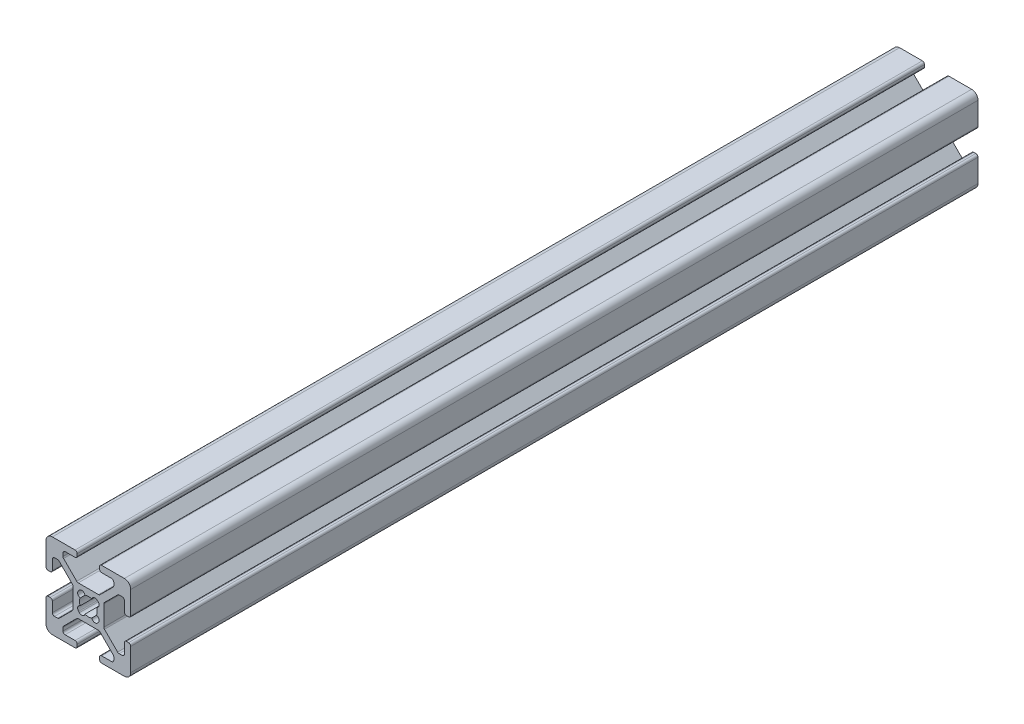
from build123d import *

# Parameters (mm, degrees)
BOSS_EXTRUDE1_DEPTH = 200


with BuildPart() as part:
    # Sketch1 → Boss-Extrude1 (new body)
    with BuildSketch(Plane(origin=(0, 0, -200), x_dir=(-1, 0, 0), z_dir=(0, 0, -1))):
        with BuildLine():
            Line((10, -8.5), (10, -3.138))
            ThreePointArc((10, -3.138), (9.851210245, -2.778789755), (9.492, -2.63))
            Line((9.492, -2.63), (9.008, -2.63))
            ThreePointArc((9.008, -2.63), (8.648789755, -2.778789755), (8.5, -3.138))
            Line((8.5, -3.138), (8.5, -5.487))
            ThreePointArc((8.5, -5.487), (8.351210245, -5.846210245), (7.992, -5.995))
            Line((7.992, -5.995), (7.26592049, -5.995))
            ThreePointArc((7.26592049, -5.995), (7.071517306, -5.956330803), (6.906710245, -5.846210245))
            Line((6.906710245, -5.846210245), (3.803789755, -2.743289755))
            ThreePointArc((3.803789755, -2.743289755), (3.693669197, -2.578482694), (3.655, -2.38407951))
            Line((3.655, -2.38407951), (3.655, 2.383759167))
            ThreePointArc((3.655, 2.383759167), (3.693669197, 2.57816235), (3.803789755, 2.742969412))
            Line((3.803789755, 2.742969412), (6.907030588, 5.846210245))
            ThreePointArc((6.907030588, 5.846210245), (7.07183765, 5.956330803), (7.266240833, 5.995))
            Line((7.266240833, 5.995), (7.992, 5.995))
            ThreePointArc((7.992, 5.995), (8.351210245, 5.846210245), (8.5, 5.487))
            Line((8.5, 5.487), (8.5, 3.138))
            ThreePointArc((8.5, 3.138), (8.648789755, 2.778789755), (9.008, 2.63))
            Line((9.008, 2.63), (9.492, 2.63))
            ThreePointArc((9.492, 2.63), (9.851210245, 2.778789755), (10, 3.138))
            Line((10, 3.138), (10, 8.5))
            ThreePointArc((10, 8.5), (9.560660172, 9.560660172), (8.5, 10))
            Line((8.5, 10), (3.138, 10))
            ThreePointArc((3.138, 10), (2.778789755, 9.851210245), (2.63, 9.492))
            Line((2.63, 9.492), (2.63, 9.008))
            ThreePointArc((2.63, 9.008), (2.778789755, 8.648789755), (3.138, 8.5))
            Line((3.138, 8.5), (5.487, 8.5))
            ThreePointArc((5.487, 8.5), (5.846210245, 8.351210245), (5.995, 7.992))
            Line((5.995, 7.992), (5.995, 7.26592049))
            ThreePointArc((5.995, 7.26592049), (5.956330803, 7.071517306), (5.846210245, 6.906710245))
            Line((5.846210245, 6.906710245), (2.743289755, 3.803789755))
            ThreePointArc((2.743289755, 3.803789755), (2.578482694, 3.693669197), (2.38407951, 3.655))
            Line((2.38407951, 3.655), (-2.383759167, 3.655))
            ThreePointArc((-2.383759167, 3.655), (-2.57816235, 3.693669197), (-2.742969412, 3.803789755))
            Line((-2.742969412, 3.803789755), (-5.846210245, 6.907030588))
            ThreePointArc((-5.846210245, 6.907030588), (-5.956330803, 7.07183765), (-5.995, 7.266240833))
            Line((-5.995, 7.266240833), (-5.995, 7.992))
            ThreePointArc((-5.995, 7.992), (-5.846210245, 8.351210245), (-5.487, 8.5))
            Line((-5.487, 8.5), (-3.138, 8.5))
            ThreePointArc((-3.138, 8.5), (-2.778789755, 8.648789755), (-2.63, 9.008))
            Line((-2.63, 9.008), (-2.63, 9.492))
            ThreePointArc((-2.63, 9.492), (-2.778789755, 9.851210245), (-3.138, 10))
            Line((-3.138, 10), (-8.5, 10))
            ThreePointArc((-8.5, 10), (-9.560660172, 9.560660172), (-10, 8.5))
            Line((-10, 8.5), (-10, 3.138))
            ThreePointArc((-10, 3.138), (-9.851210245, 2.778789755), (-9.492, 2.63))
            Line((-9.492, 2.63), (-9.008, 2.63))
            ThreePointArc((-9.008, 2.63), (-8.648789755, 2.778789755), (-8.5, 3.138))
            Line((-8.5, 3.138), (-8.5, 5.487))
            ThreePointArc((-8.5, 5.487), (-8.351210245, 5.846210245), (-7.992, 5.995))
            Line((-7.992, 5.995), (-7.26592049, 5.995))
            ThreePointArc((-7.26592049, 5.995), (-7.071517306, 5.956330803), (-6.906710245, 5.846210245))
            Line((-6.906710245, 5.846210245), (-3.803789755, 2.743289755))
            ThreePointArc((-3.803789755, 2.743289755), (-3.693669197, 2.578482694), (-3.655, 2.38407951))
            Line((-3.655, 2.38407951), (-3.655, -2.383759167))
            ThreePointArc((-3.655, -2.383759167), (-3.693669197, -2.57816235), (-3.803789755, -2.742969412))
            Line((-3.803789755, -2.742969412), (-6.907030588, -5.846210245))
            ThreePointArc((-6.907030588, -5.846210245), (-7.07183765, -5.956330803), (-7.266240833, -5.995))
            Line((-7.266240833, -5.995), (-7.992, -5.995))
            ThreePointArc((-7.992, -5.995), (-8.351210245, -5.846210245), (-8.5, -5.487))
            Line((-8.5, -5.487), (-8.5, -3.138))
            ThreePointArc((-8.5, -3.138), (-8.648789755, -2.778789755), (-9.008, -2.63))
            Line((-9.008, -2.63), (-9.492, -2.63))
            ThreePointArc((-9.492, -2.63), (-9.851210245, -2.778789755), (-10, -3.138))
            Line((-10, -3.138), (-10, -8.5))
            ThreePointArc((-10, -8.5), (-9.560660172, -9.560660172), (-8.5, -10))
            Line((-8.5, -10), (-3.138, -10))
            ThreePointArc((-3.138, -10), (-2.778789755, -9.851210245), (-2.63, -9.492))
            Line((-2.63, -9.492), (-2.63, -9.008))
            ThreePointArc((-2.63, -9.008), (-2.778789755, -8.648789755), (-3.138, -8.5))
            Line((-3.138, -8.5), (-5.487, -8.5))
            ThreePointArc((-5.487, -8.5), (-5.846210245, -8.351210245), (-5.995, -7.992))
            Line((-5.995, -7.992), (-5.995, -7.26592049))
            ThreePointArc((-5.995, -7.26592049), (-5.956330803, -7.071517306), (-5.846210245, -6.906710245))
            Line((-5.846210245, -6.906710245), (-2.743289755, -3.803789755))
            ThreePointArc((-2.743289755, -3.803789755), (-2.578482694, -3.693669197), (-2.38407951, -3.655))
            Line((-2.38407951, -3.655), (2.383759167, -3.655))
            ThreePointArc((2.383759167, -3.655), (2.57816235, -3.693669197), (2.742969412, -3.803789755))
            Line((2.742969412, -3.803789755), (5.846210245, -6.907030588))
            ThreePointArc((5.846210245, -6.907030588), (5.956330803, -7.07183765), (5.995, -7.266240833))
            Line((5.995, -7.266240833), (5.995, -7.992))
            ThreePointArc((5.995, -7.992), (5.846210245, -8.351210245), (5.487, -8.5))
            Line((5.487, -8.5), (3.138, -8.5))
            ThreePointArc((3.138, -8.5), (2.778789755, -8.648789755), (2.63, -9.008))
            Line((2.63, -9.008), (2.63, -9.492))
            ThreePointArc((2.63, -9.492), (2.778789755, -9.851210245), (3.138, -10))
            Line((3.138, -10), (8.5, -10))
            ThreePointArc((8.5, -10), (9.560660172, -9.560660172), (10, -8.5))
        make_face()
        with BuildLine():
            Line((2.304493037, -2.124493037), (2.124493037, -2.304493037))
            ThreePointArc((2.124493037, -2.304493037), (1.35638567, -2.506016078), (0.803729988, -1.935777391))
            ThreePointArc((0.803729988, -1.935777391), (0, -2.096), (-0.803729988, -1.935777391))
            ThreePointArc((-0.803729988, -1.935777391), (-1.35638567, -2.506016078), (-2.124493037, -2.304493037))
            Line((-2.124493037, -2.304493037), (-2.304493037, -2.124493037))
            ThreePointArc((-2.304493037, -2.124493037), (-2.506016078, -1.35638567), (-1.935777391, -0.803729988))
            ThreePointArc((-1.935777391, -0.803729988), (-2.096, 0), (-1.935777391, 0.803729988))
            ThreePointArc((-1.935777391, 0.803729988), (-2.506016078, 1.35638567), (-2.304493037, 2.124493037))
            Line((-2.304493037, 2.124493037), (-2.124493037, 2.304493037))
            ThreePointArc((-2.124493037, 2.304493037), (-1.35638567, 2.506016078), (-0.803729988, 1.935777391))
            ThreePointArc((-0.803729988, 1.935777391), (0, 2.096), (0.803729988, 1.935777391))
            ThreePointArc((0.803729988, 1.935777391), (1.35638567, 2.506016078), (2.124493037, 2.304493037))
            Line((2.124493037, 2.304493037), (2.304493037, 2.124493037))
            ThreePointArc((2.304493037, 2.124493037), (2.506016078, 1.35638567), (1.935777391, 0.803729988))
            ThreePointArc((1.935777391, 0.803729988), (2.096, 0), (1.935777391, -0.803729988))
            ThreePointArc((1.935777391, -0.803729988), (2.506016078, -1.35638567), (2.304493037, -2.124493037))
        make_face(mode=Mode.SUBTRACT)
    extrude(amount=-BOSS_EXTRUDE1_DEPTH)


solid = part.part
